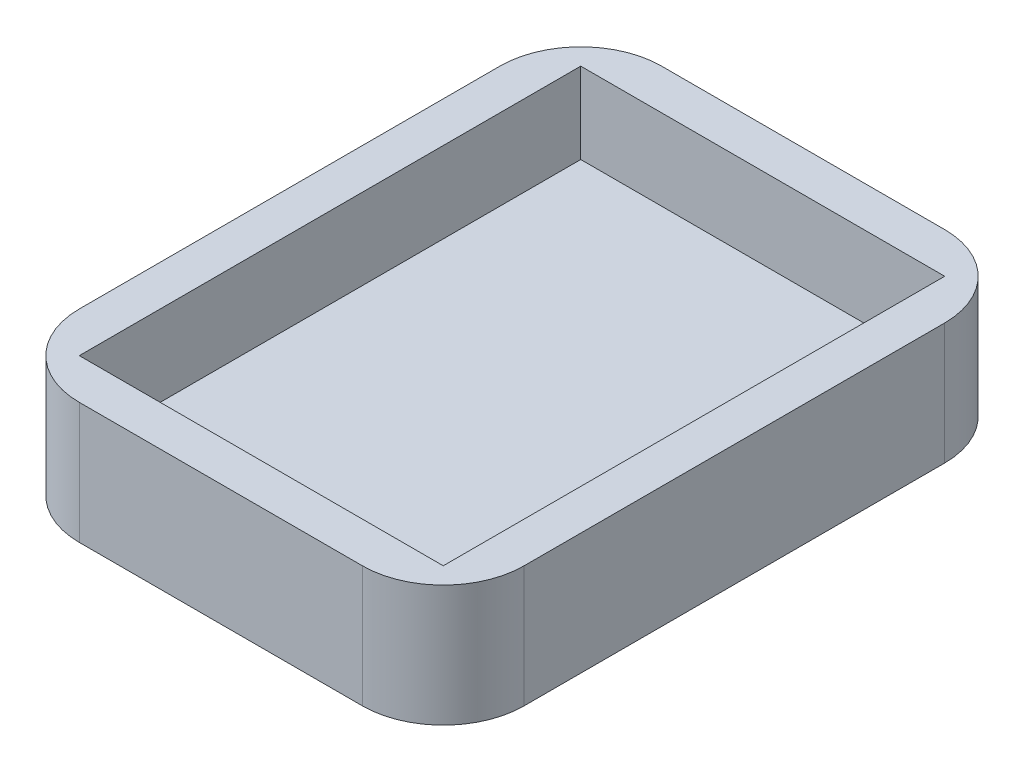
from build123d import *

# Parameters (mm, degrees)
SKETCH2_W                = 45
SKETCH2_H                = 62
BOSS_EXTRUDE1_DEPTH      = 5
BOSS_EXTRUDE2_DEPTH      = 10
BOSS_EXTRUDE2_DEPTH_BACK = 5
SKETCH3_W                = 55
SKETCH3_H                = 72
SKETCH3_W_2              = 45
SKETCH3_H_2              = 62
FILLET1_R                = 10


with BuildPart() as part:
    # Sketch2 → Boss-Extrude1 (new body)
    with BuildSketch(Plane(origin=(0, 0, 0), x_dir=(1, 0, 0), z_dir=(0, 1, 0))):
        with Locations((22.5, 31)):
            Rectangle(SKETCH2_W, SKETCH2_H)
    extrude(amount=BOSS_EXTRUDE1_DEPTH)

    # Sketch3 → Boss-Extrude2 (add, two sides: drawn at the far end of the back side and taken through both)
    with BuildSketch(Plane(origin=(0, 5, 0), x_dir=(1, 0, 0), z_dir=(0, 1, 0)).offset(-BOSS_EXTRUDE2_DEPTH_BACK)):
        with Locations((22.5, 31)):
            Rectangle(SKETCH3_W, SKETCH3_H)
        with Locations((22.5, 31)):
            Rectangle(SKETCH3_W_2, SKETCH3_H_2, mode=Mode.SUBTRACT)
    extrude(amount=BOSS_EXTRUDE2_DEPTH + BOSS_EXTRUDE2_DEPTH_BACK)

    # Fillet1
    fillet1_edges = [part.edges().sort_by_distance(p)[0] for p in [
        (50, 7.5, 5),
        (-5, 7.5, 5),
        (-5, 7.5, -67),
        (50, 7.5, -67),
    ]]
    fillet(fillet1_edges, radius=FILLET1_R)


solid = part.part
